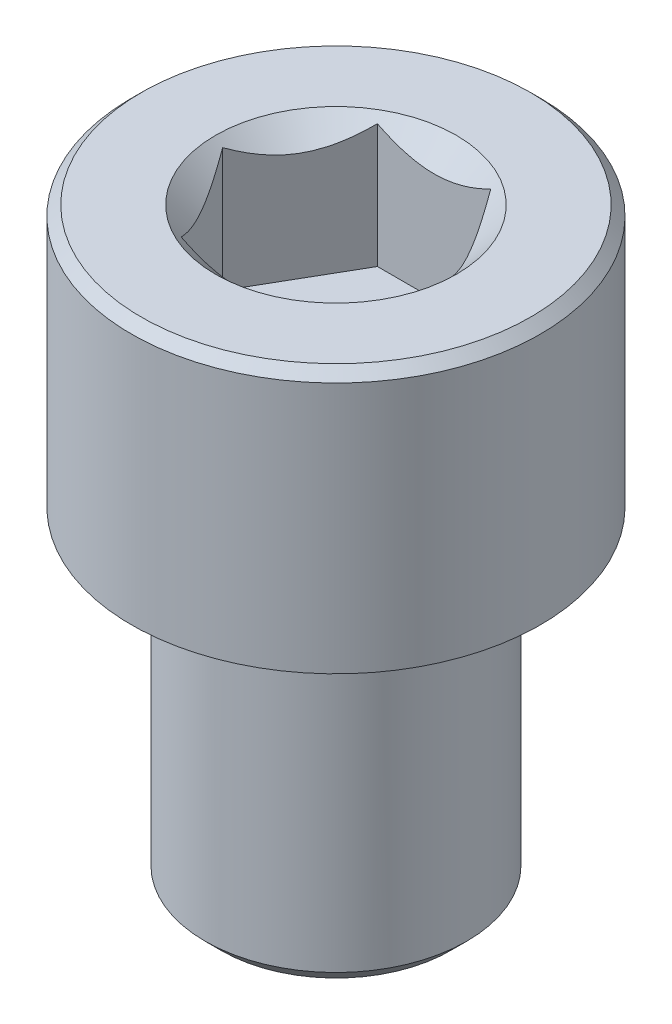
from build123d import *

# Parameters (mm, degrees)
WYCI_GNI_CIE1_DEPTH        = 4
SFAZOWANIE1_SIZE           = 0.3
SZKIC3_R                   = 3.68172134
WYTNIJ_WYCI_GNI_CIE1_DEPTH = 2
WYTNIJ_WYCI_GNI_CIE1_DRAFT = -45
SFAZOWANIE2_SIZE           = 0.5


with BuildPart() as part:
    # Szkic1 → Obrót1 (revolve)
    with BuildSketch(Plane.XY, mode=Mode.PRIVATE) as obr_t1_sk:
        Polygon((0, 0), (-4, 0), (-4, 10), (-6.25, 10), (-6.25, 18), (0, 18), align=None)
    revolve(obr_t1_sk.sketch.rotate(Axis((0, 0, 0), (0, 1, 0)), 270), axis=Axis((0, 0, 0), (0, 1, 0)))

    # Szkic2 → Wyciągnięcie1 (cut)
    with BuildSketch(Plane(origin=(0, 18, 0), x_dir=(1, 0, 0), z_dir=(0, 1, 0))):
        Polygon((3.464101615, 0), (1.732050808, 3), (-1.732050808, 3), (-3.464101615, 0), (-1.732050808, -3), (1.732050808, -3), align=None)
    extrude(amount=-WYCI_GNI_CIE1_DEPTH, mode=Mode.SUBTRACT)

    # Sfazowanie1
    sfazowanie1_edges = [part.edges().sort_by_distance(p)[0] for p in [
        (0, 18, 6.25),
    ]]
    chamfer(sfazowanie1_edges, length=SFAZOWANIE1_SIZE)


with BuildPart() as wytnij_wyci_gni_cie1_tool:
    # Szkic3 → Wytnij-wyciągnięcie1 (with draft: the straight prism first)
    with BuildSketch(Plane(origin=(0, 18, 0), x_dir=(1, 0, 0), z_dir=(0, 1, 0))):
        Circle(SZKIC3_R)
    extrude(amount=-WYTNIJ_WYCI_GNI_CIE1_DEPTH)
    # Wytnij-wyciągnięcie1: the draft: its side faces are tilted about the plane it starts from
    wytnij_wyci_gni_cie1_sides = [wytnij_wyci_gni_cie1_tool.faces().sort_by_distance(p)[0] for p in [
        (-3.68172134, 17, 0),
    ]]
    draft(wytnij_wyci_gni_cie1_sides, Plane(origin=(0, 18, 0), x_dir=(1, 0, 0), z_dir=(0, 1, 0)), WYTNIJ_WYCI_GNI_CIE1_DRAFT)


with BuildPart() as part_1:
    add(part.part)

    # Wytnij-wyciągnięcie1: cut by wytnij_wyci_gni_cie1_tool
    add(wytnij_wyci_gni_cie1_tool.part, mode=Mode.SUBTRACT)

    # Sfazowanie2
    sfazowanie2_edges = [part_1.edges().sort_by_distance(p)[0] for p in [
        (0, 0, 4),
    ]]
    chamfer(sfazowanie2_edges, length=SFAZOWANIE2_SIZE)


solid = part_1.part
